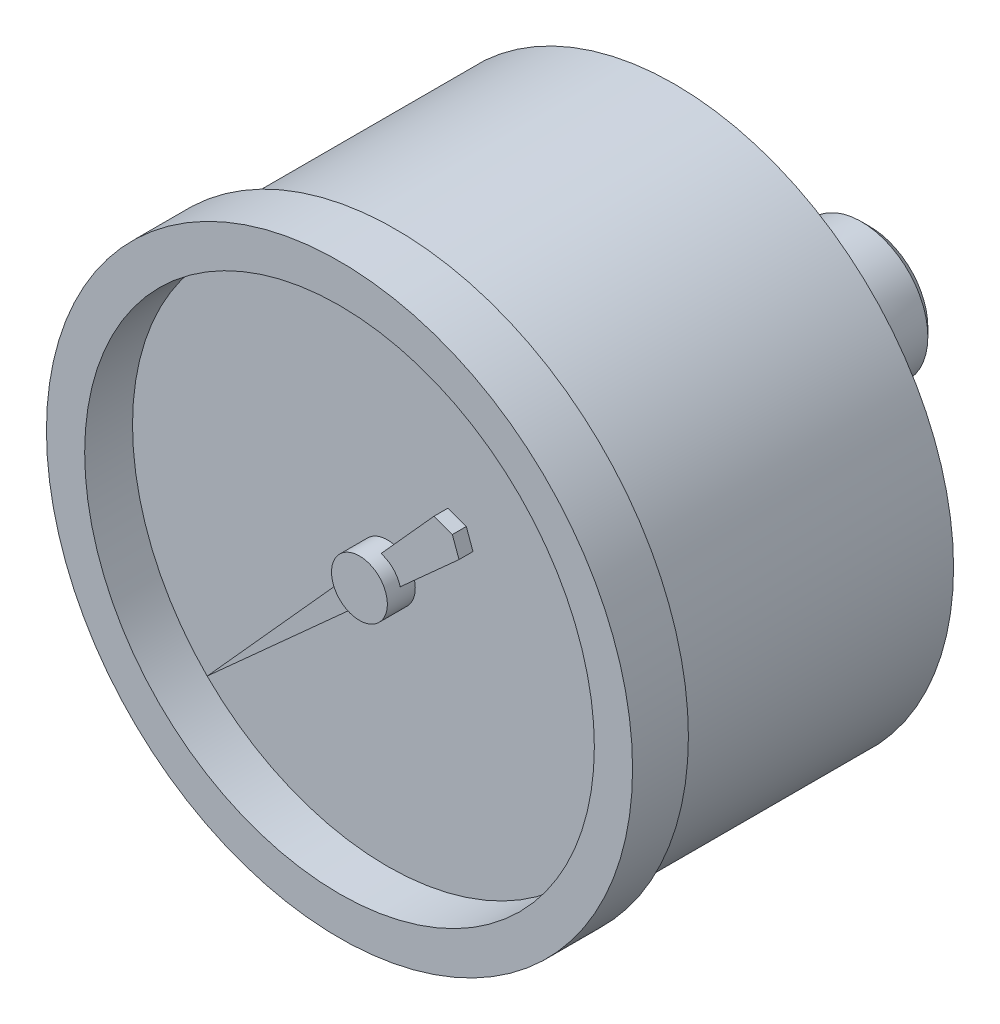
from build123d import *

# Parameters (mm, degrees)
EXTRUDE_1_DEPTH     = 1
SKETCH_3_R          = 2
EXTRUDE_2_DEPTH     = 2
SKETCH_4_W          = 36.891891892
SKETCH_4_H          = 44.115479116
SKETCH_4_W_2        = 11
SKETCH_4_H_2        = 11
CUT_EXTRUDE_1_DEPTH = 14


with BuildPart() as part:
    # 草图1 → 旋转1 (revolve)
    with BuildSketch(Plane(origin=(0, 0, 0), x_dir=(0, 0, -1), z_dir=(1, 0, 0))):
        Polygon((-34.571428571, 0), (-34.571428571, 18.260869565), (-38, 18.260869565), (-38, 21), (-34, 21), (-34, 20), (-14, 20), (-14, 7.586206897), (-8.4, 7.586206897), (-8.4, 5.001506871), (-0.600035703, 4.757745806), (0, 4.157710103), (0, 0), align=None)
    revolve(axis=Axis((0, 0, 0), (0, 0, 1)))

    # 草图2 → 凸台-拉伸1 (add)
    with BuildSketch(Plane.XY.offset(34.571428571)):
        Polygon((-11.879393924, -11.879393924), (6.135636089, 4.341411958), (5.656854249, 5.656854249), (4.341411958, 6.135636089), align=None)
    extrude(amount=EXTRUDE_1_DEPTH)

    # 草图3 → 凸台-拉伸2 (add)
    with BuildSketch(Plane.XY.offset(34.571428571)):
        Circle(SKETCH_3_R)
    extrude(amount=EXTRUDE_2_DEPTH)

    # 草图4 → 切除-拉伸1 (cut)
    with BuildSketch(Plane.XY):
        with Locations((-1.160933661, -1.547911548)):
            Rectangle(SKETCH_4_W, SKETCH_4_H)
        Rectangle(SKETCH_4_W_2, SKETCH_4_H_2, mode=Mode.SUBTRACT)
    extrude(amount=CUT_EXTRUDE_1_DEPTH, mode=Mode.SUBTRACT)


solid = part.part
